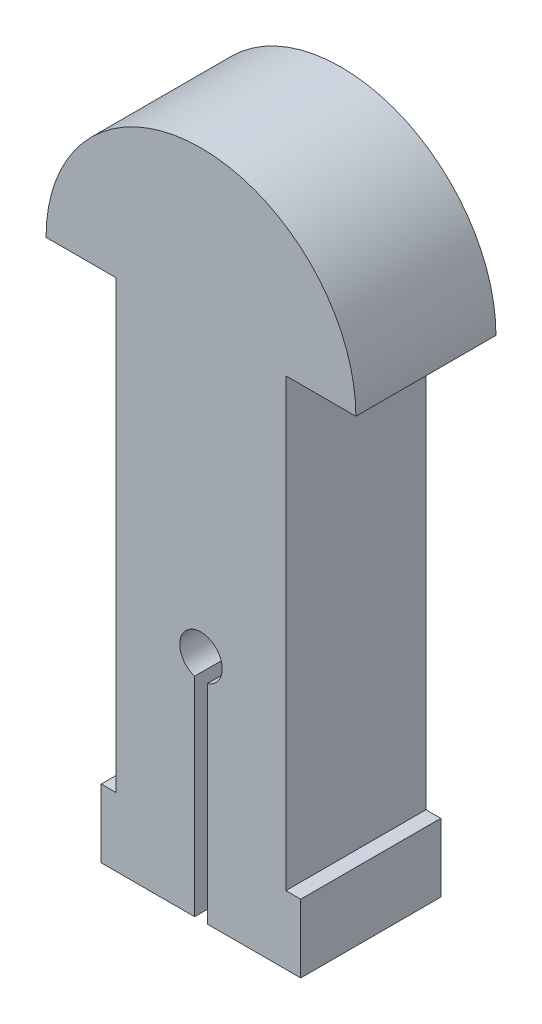
from build123d import *

# Parameters (mm, degrees)
SALIENTE_EXTRUIR1_DEPTH = 3.3


with BuildPart() as part:
    # Croquis1 → Saliente-Extruir1 (new body)
    with BuildSketch(Plane.XY):
        with BuildLine():
            Line((-0.15, -6.133444496), (-0.15, -9.433444496))
            Line((-0.15, -9.433444496), (-0.15, -11.04132323))
            Line((-0.15, -11.04132323), (-2.35, -11.04132323))
            Line((-2.35, -11.04132323), (-2.35, -9.433444496))
            Line((-2.35, -9.433444496), (-2, -9.433444496))
            Line((-2, -9.433444496), (-2, 1.070879644))
            Line((-2, 1.070879644), (-3.65, 1.070879644))
            ThreePointArc((-3.65, 1.070879644), (0, 4.720879644), (3.65, 1.070879644))
            Line((3.65, 1.070879644), (2, 1.070879644))
            Line((2, 1.070879644), (2, -9.433444496))
            Line((2, -9.433444496), (2.35, -9.433444496))
            Line((2.35, -9.433444496), (2.35, -11.04132323))
            Line((2.35, -11.04132323), (0.15, -11.04132323))
            Line((0.15, -11.04132323), (0.15, -9.433444496))
            Line((0.15, -9.433444496), (0.15, -6.133444496))
            ThreePointArc((0.15, -6.133444496), (0, -5.156474895), (-0.15, -6.133444496))
        make_face()
    extrude(amount=SALIENTE_EXTRUIR1_DEPTH)


solid = part.part
